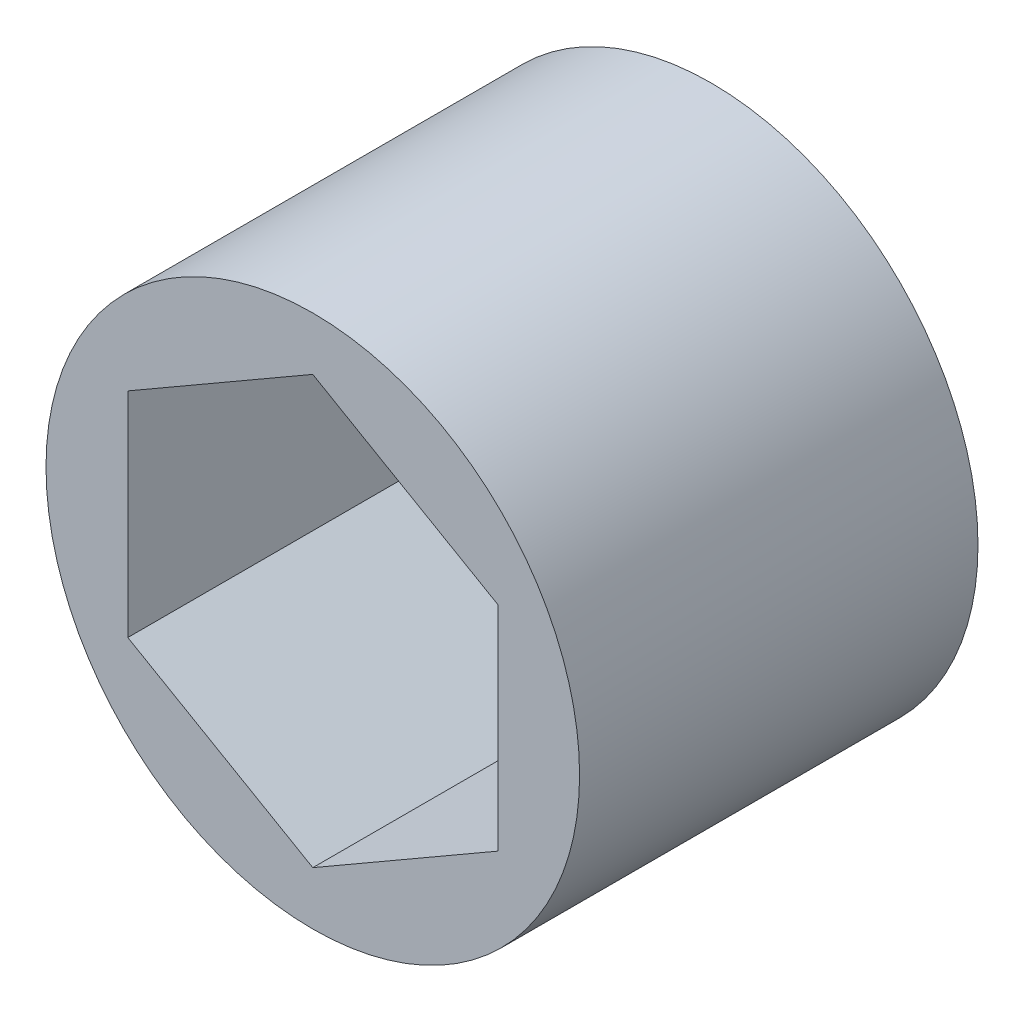
from build123d import *

# Parameters (mm, degrees)
SKETCH1_R           = 9.525
BOSS_EXTRUDE1_DEPTH = 7.112


with BuildPart() as part:
    # Sketch1 → Boss-Extrude1 (new, symmetric)
    with BuildSketch(Plane.XY):
        Circle(SKETCH1_R)
        Polygon((0, 7.625642355), (-6.604, 3.812821178), (-6.604, -3.812821178), (0, -7.625642355), (6.604, -3.812821178), (6.604, 3.812821178), align=None, mode=Mode.SUBTRACT)
    extrude(amount=BOSS_EXTRUDE1_DEPTH, both=True)


solid = part.part
